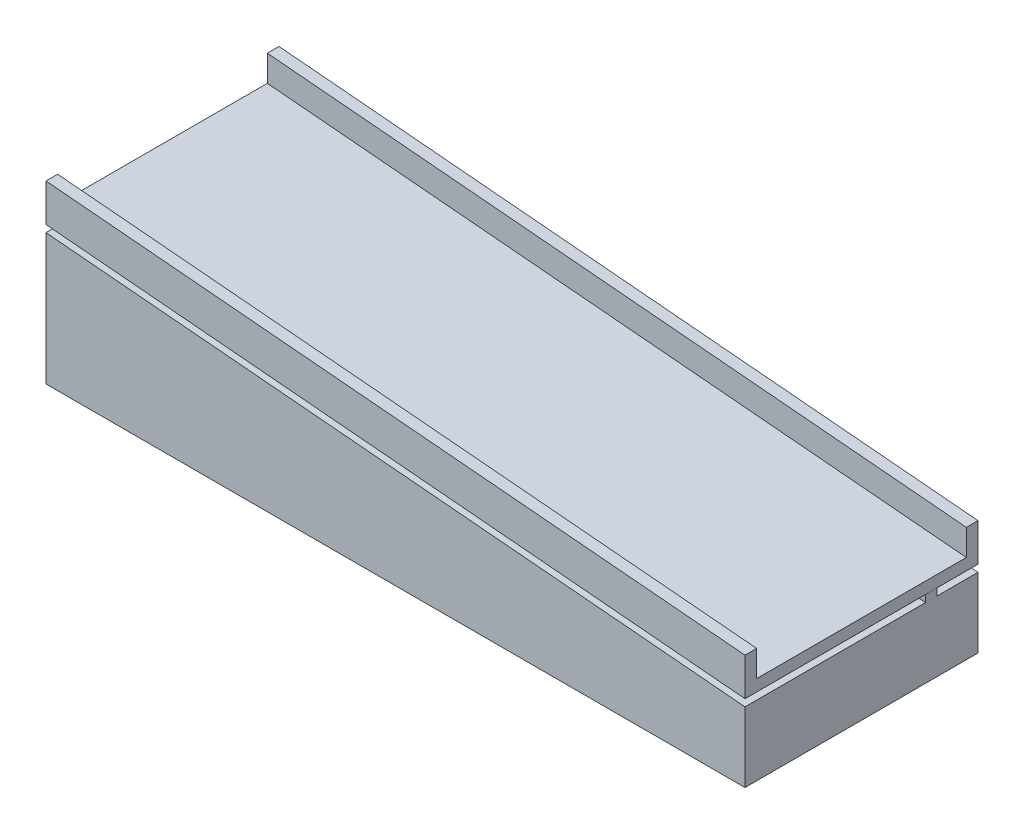
from build123d import *

# Parameters (mm, degrees)
SALIENTE_EXTRUIR1_DEPTH = 100
SALIENTE_EXTRUIR2_DEPTH = 2.5


with BuildPart() as part:
    # Croquis1 → Saliente-Extruir1 (new body)
    with BuildSketch(Plane.XY):
        Polygon((0, 0), (0, 56.246599058), (300, 30), (300, 0), align=None)
    extrude(amount=SALIENTE_EXTRUIR1_DEPTH)

    # Croquis3 → Saliente-Extruir2 (add, symmetric)
    with BuildSketch(Plane.XY.offset(20)):
        Polygon((0, 56.246599058), (300, 30), (300, 33), (0, 59.246599058), align=None)
    extrude(amount=SALIENTE_EXTRUIR2_DEPTH, both=True)


with BuildPart() as body_2:
    # Barrer1: sweep along a path in Croquis4
    with BuildLine(Plane.XY.offset(20)) as barrer1_path:
        Line((0, 59.246599058), (300, 33))
    # Croquis5 → Barrer1 (sweep)
    with BuildSketch(Plane.ZY):
        Polygon((95, 75.457706055), (100, 75.457706055), (100, 59.25776596), (0, 59.25776596), (0, 75.457706055), (5, 75.457706055), (5, 64.25776596), (95, 64.25776596), align=None)
    sweep(path=barrer1_path.line)


solid = Compound([part.part, body_2.part])
